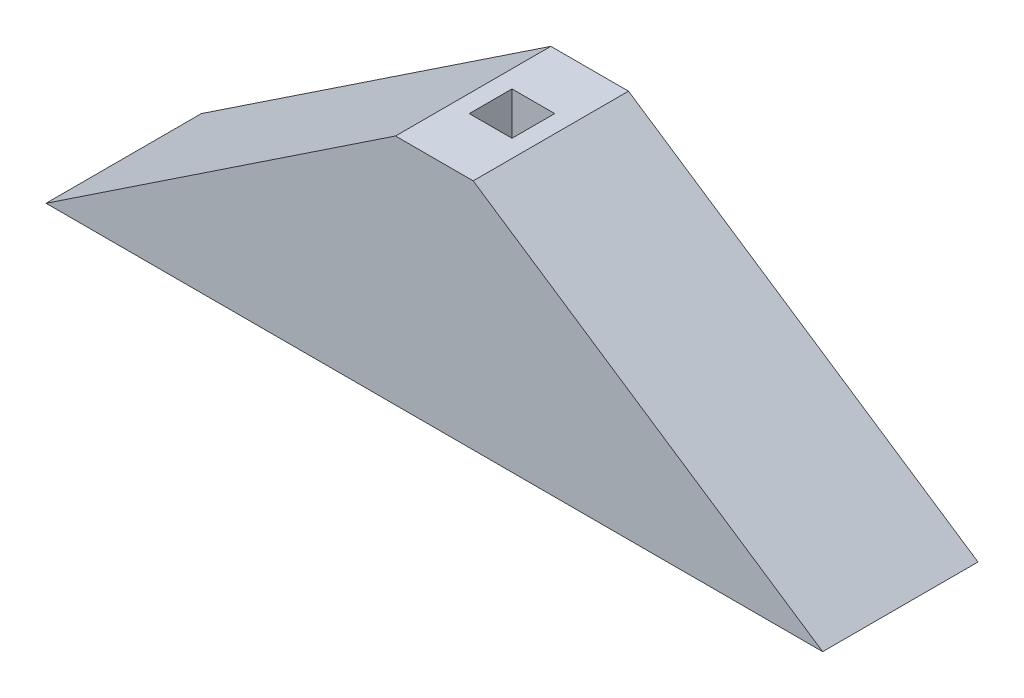
from build123d import *

# Parameters (mm, degrees)
BOSS_EXTRUDE1_DEPTH = 50.8
SKETCH2_W           = 13.97
SKETCH2_H           = 13.97
CUT_EXTRUDE1_DEPTH  = 63.5


with BuildPart() as part:
    # Sketch1 → Boss-Extrude1 (new body)
    with BuildSketch(Plane.XY):
        Polygon((-127, 0), (127, 0), (12.7, 76.2), (-12.7, 76.2), align=None)
    extrude(amount=BOSS_EXTRUDE1_DEPTH)

    # Sketch2 → Cut-Extrude1 (cut)
    with BuildSketch(Plane(origin=(0, 76.2, 0), x_dir=(1, 0, 0), z_dir=(0, 1, 0))):
        with Locations((0, -25.4)):
            Rectangle(SKETCH2_W, SKETCH2_H)
    extrude(amount=-CUT_EXTRUDE1_DEPTH, mode=Mode.SUBTRACT)


solid = part.part
